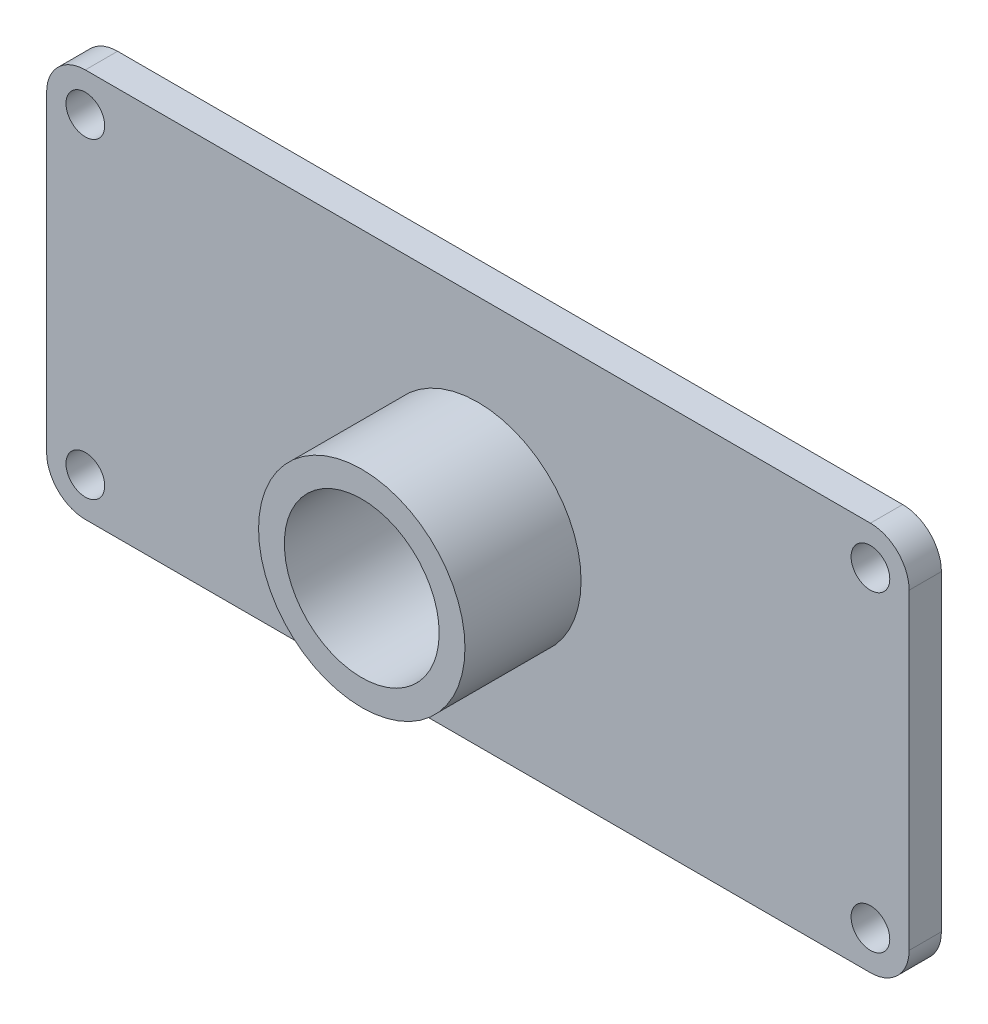
from build123d import *

# Parameters (mm, degrees)
SKETCH1_R           = 12000
SKETCH1_R_2         = 3000
BOSS_EXTRUDE2_DEPTH = 5000
SKETCH2_R           = 16000
SKETCH2_R_2         = 12000
BOSS_EXTRUDE3_DEPTH = 18000


with BuildPart() as part:
    # Sketch1 → Boss-Extrude2 (new body)
    with BuildSketch(Plane.XY):
        with BuildLine():
            Line((61568.986707958, -21050.807931945), (183274.151255793, -21050.807931945))
            ThreePointArc((183274.151255793, -21050.807931945), (187516.791942913, -22808.167244826), (189274.151255793, -27050.807931945))
            Line((189274.151255793, -27050.807931945), (189274.151255793, -75407.489196212))
            ThreePointArc((189274.151255793, -75407.489196212), (187516.791942913, -79650.129883331), (183274.151255793, -81407.489196212))
            Line((183274.151255793, -81407.489196212), (61568.986707958, -81407.489196212))
            ThreePointArc((61568.986707958, -81407.489196212), (57326.346020839, -79650.129883331), (55568.986707958, -75407.489196212))
            Line((55568.986707958, -75407.489196212), (55568.986707958, -27050.807931945))
            ThreePointArc((55568.986707958, -27050.807931945), (57326.346020839, -22808.167244826), (61568.986707958, -21050.807931945))
        make_face()
        with Locations((122421.568981876, -51229.148564079)):
            Circle(SKETCH1_R, mode=Mode.SUBTRACT)
        with Locations((61568.986707958, -27050.807931945)):
            Circle(SKETCH1_R_2, mode=Mode.SUBTRACT)
        with Locations((183274.151255793, -27050.807931945)):
            Circle(SKETCH1_R_2, mode=Mode.SUBTRACT)
        with Locations((183274.151255793, -75407.489196212)):
            Circle(SKETCH1_R_2, mode=Mode.SUBTRACT)
        with Locations((61568.986707958, -75407.489196212)):
            Circle(SKETCH1_R_2, mode=Mode.SUBTRACT)
    extrude(amount=BOSS_EXTRUDE2_DEPTH)

    # Sketch2 → Boss-Extrude3 (add)
    with BuildSketch(Plane.XY.offset(5000)):
        with Locations((122421.568981876, -51229.148564079)):
            Circle(SKETCH2_R)
        with Locations((122421.568981876, -51229.148564079)):
            Circle(SKETCH2_R_2, mode=Mode.SUBTRACT)
    extrude(amount=BOSS_EXTRUDE3_DEPTH)


solid = part.part
